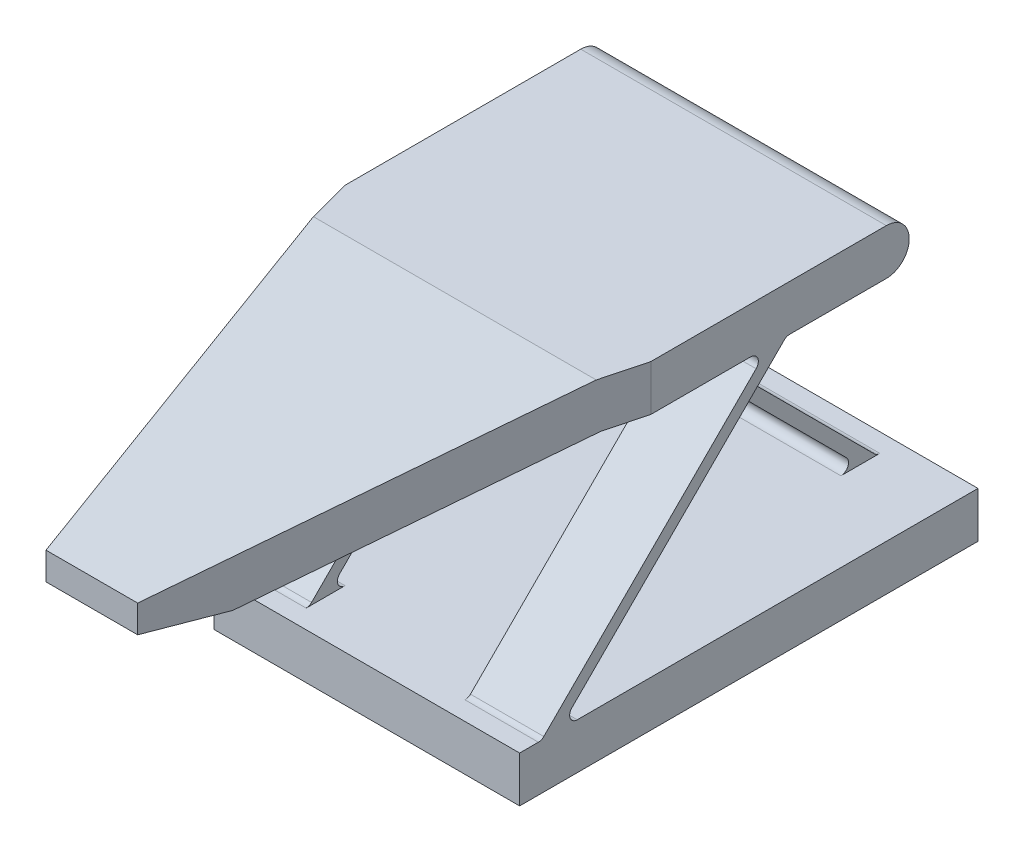
from build123d import *

# Parameters (mm, degrees)
BOSS_EXTRUDE1_DEPTH   = 10
SKETCH1_W             = 30
SKETCH1_H             = 3
BOSS_EXTRUDE1_2_DEPTH = 10
BOSS_EXTRUDE2_DEPTH   = 4.8
BOSS_EXTRUDE3_START   = 5.2
BOSS_EXTRUDE3_DEPTH   = 4.8
FILLET1_R             = 0.5
CUT_EXTRUDE1_REACH    = 55.298


with BuildPart() as part:
    # Sketch1 → Boss-Extrude1 (new, symmetric)
    with BuildSketch(Plane(origin=(0, 0, 0), x_dir=(0, 0, -1), z_dir=(1, 0, 0))):
        with BuildLine():
            Line((0, 13), (0, 11.2))
            Line((0, 11.2), (4.930378913, 10.768647738))
            Line((4.930378913, 10.768647738), (24, 13.896674439))
            Line((24, 13.896674439), (42, 13.896674439))
            ThreePointArc((42, 13.896674439), (43.5, 15.396674439), (42, 16.896674439))
            Line((42, 16.896674439), (23.755585281, 16.896674439))
            Line((23.755585281, 16.896674439), (0, 13))
        make_face()
    extrude(amount=BOSS_EXTRUDE1_DEPTH, both=True)



with BuildPart() as body_2:
    # Sketch1 → Boss-Extrude1 2 (new, symmetric)
    with BuildSketch(Plane(origin=(0, 0, 0), x_dir=(0, 0, -1), z_dir=(1, 0, 0))):
        with Locations((33, -2.5)):
            Rectangle(SKETCH1_W, SKETCH1_H)
    extrude(amount=BOSS_EXTRUDE1_2_DEPTH, both=True)


with BuildPart() as part_1:
    add(part.part)

    add(body_2.part)  # Boss-Extrude2 merges body 2
    # Sketch2 → Boss-Extrude2 (add, symmetric)
    with BuildSketch(Plane(origin=(0, 0, 0), x_dir=(0, 0, -1), z_dir=(1, 0, 0))):
        Polygon((30.537640136, 13.896674439), (45.434314575, -1), (46.565685425, -1), (31.669010986, 13.896674439), align=None)
    extrude(amount=BOSS_EXTRUDE2_DEPTH, both=True)

    # Sketch3 → Boss-Extrude3 (add)
    with BuildSketch(Plane(origin=(0, 0, 0), x_dir=(0, 0, -1), z_dir=(1, 0, 0)).offset(BOSS_EXTRUDE3_START)):
        Polygon((19.434314575, -1), (20.565685425, -1), (35.462359864, 13.896674439), (34.330989014, 13.896674439), align=None)
    boss_extrude3 = extrude(amount=BOSS_EXTRUDE3_DEPTH)

    # Mirror1: Boss-Extrude3 across plane
    add(boss_extrude3.mirror(Plane(origin=(0, 0, 0), x_dir=(0, 0, 1), z_dir=(1, 0, 0))))

    # Fillet1
    fillet1_edges = [part_1.edges().sort_by_distance(p)[0] for p in [
        (-7.6, -1, -20.565685425),
        (-7.6, -1, -19.434314575),
        (7.6, -1, -19.434314575),
        (7.6, -1, -20.565685425),
        (0, -1, -45.434314575),
        (0, -1, -46.565685425),
        (0, 13.896674439, -31.669010986),
        (0, 13.896674439, -30.537640136),
        (7.6, 13.896674439, -34.330989014),
        (7.6, 13.896674439, -35.462359864),
    ]]
    fillet(fillet1_edges, radius=FILLET1_R)

    # Sketch4 → Cut-Extrude1 (cut, up to next)
    with BuildSketch(Plane(origin=(0, 16.896674439, 0), x_dir=(1, 0, 0), z_dir=(0, 1, 0)), mode=Mode.PRIVATE) as cut_extrude1_sk1:
        Polygon((-3, 0), (-10, 26.585294569), (-10, 0), align=None)
    cut_extrude1_tool1 = extrude(cut_extrude1_sk1.sketch, amount=-CUT_EXTRUDE1_REACH, mode=Mode.PRIVATE) & part_1.part
    # Sketch4 → Cut-Extrude1 (cut, up to next)
    with BuildSketch(Plane(origin=(0, 16.896674439, 0), x_dir=(1, 0, 0), z_dir=(0, 1, 0)), mode=Mode.PRIVATE) as cut_extrude1_sk2:
        Polygon((3, 0), (10, 0), (10, 26.585294569), align=None)
    cut_extrude1_tool2 = extrude(cut_extrude1_sk2.sketch, amount=-CUT_EXTRUDE1_REACH, mode=Mode.PRIVATE) & part_1.part
    add(cut_extrude1_tool1.solids().sort_by_distance((-7.666667, 16.896674, -8.861765))[0], mode=Mode.SUBTRACT)
    add(cut_extrude1_tool2.solids().sort_by_distance((7.666667, 16.896674, -8.861765))[0], mode=Mode.SUBTRACT)


solid = part_1.part
